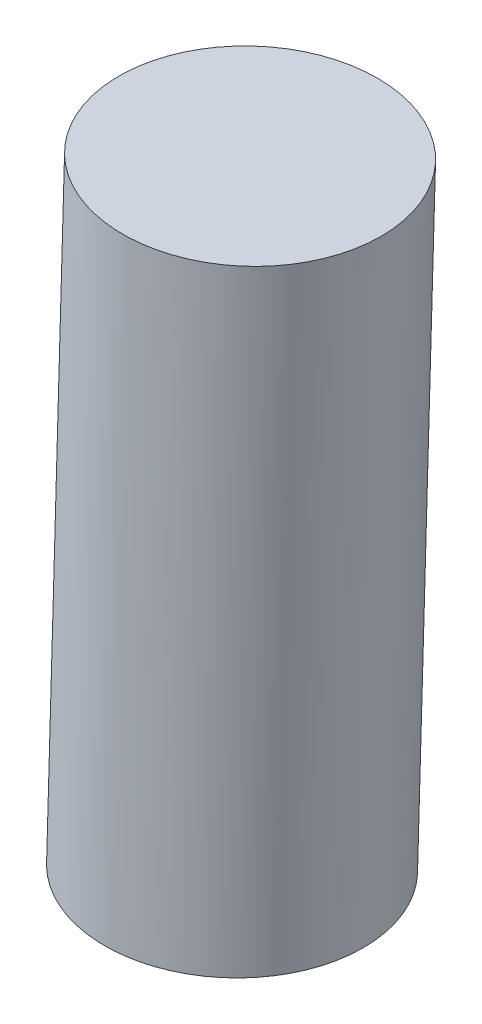
from build123d import *


with BuildPart() as part:
    # Esquisse1 → Révolution1 (revolve)
    with BuildSketch(Plane.XY.offset(-92.992140511)):
        Polygon((-217.223211463, -5.388036754), (-224.22031322, -5.186624249), (-225.180339886, -38.538100006), (-218.183238128, -38.739512511), align=None)
    revolve(axis=Axis((-224.214520334, -4.985378493, -92.992140511), (-0.028773214958104507, -0.9995859653381368, 0)))


solid = part.part
